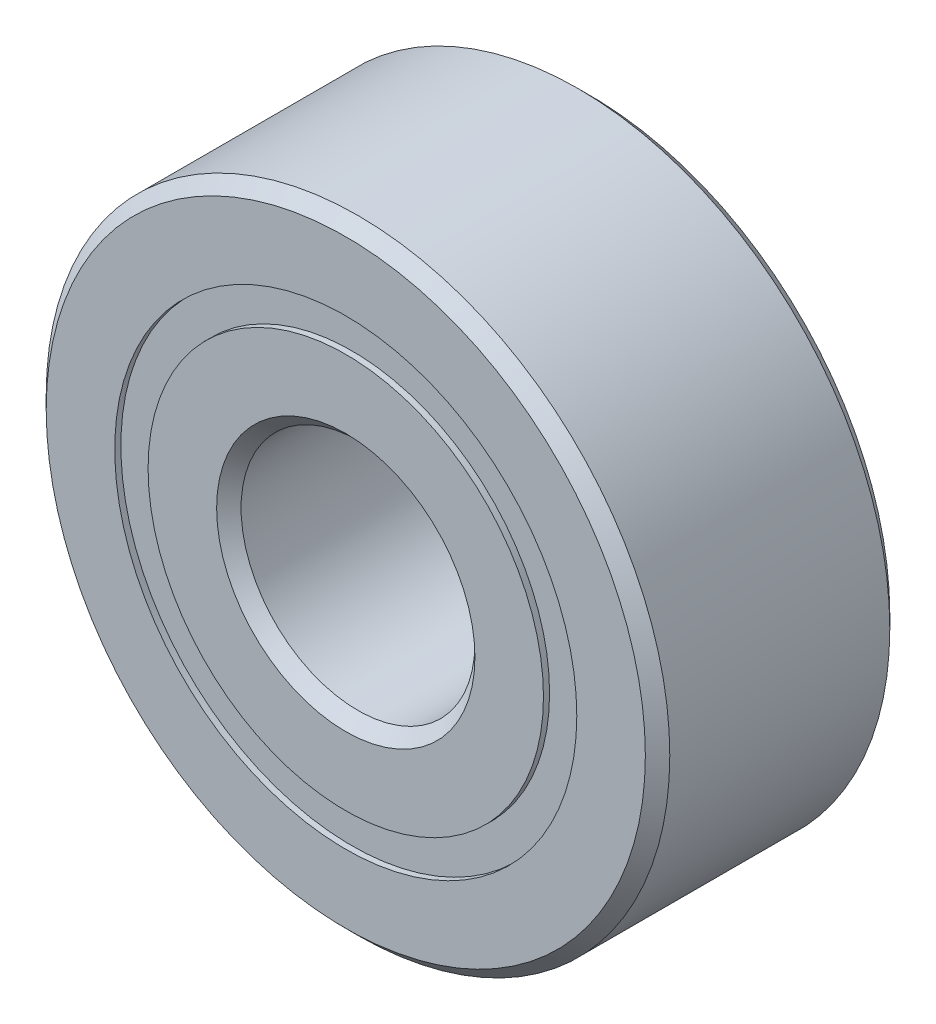
from build123d import *

# Parameters (mm, degrees)
CIRPATTERN1_COUNT = 10
SKETCH5_W         = 1.207534705
SKETCH5_H         = 0.678821978


with BuildPart() as part:
    # Sketch1 → Revolve1 (revolve)
    with BuildSketch(Plane(origin=(0, 0, 0), x_dir=(0, 0, -1), z_dir=(1, 0, 0))):
        with BuildLine():
            Line((2.24028, 6.35), (-2.24028, 6.35))
            Line((-2.24028, 6.35), (-2.4892, 6.10108))
            Line((-2.4892, 6.10108), (-2.4892, 4.705035989))
            Line((-2.4892, 4.705035989), (-1.106311111, 4.705035989))
            ThreePointArc((-1.106311111, 4.705035989), (0, 5.522830295), (1.106311111, 4.705035989))
            Line((1.106311111, 4.705035989), (2.4892, 4.705035989))
            Line((2.4892, 4.705035989), (2.4892, 6.10108))
            Line((2.4892, 6.10108), (2.24028, 6.35))
        make_face()
    revolve(axis=Axis((0, 0, 2.4892), (0, 0, -1)))


with BuildPart() as body_2:
    # Sketch3 → Revolve3 (revolve)
    with BuildSketch(Plane(origin=(0, 0, 0), x_dir=(0, 0, -1), z_dir=(1, 0, 0))):
        with BuildLine():
            Line((-1.106311111, 4.026214011), (-2.4892, 4.026214011))
            Line((-2.4892, 4.026214011), (-2.4892, 2.63017))
            Line((-2.4892, 2.63017), (-2.24028, 2.38125))
            Line((-2.24028, 2.38125), (2.24028, 2.38125))
            Line((2.24028, 2.38125), (2.4892, 2.63017))
            Line((2.4892, 2.63017), (2.4892, 4.026214011))
            Line((2.4892, 4.026214011), (1.106311111, 4.026214011))
            ThreePointArc((1.106311111, 4.026214011), (0, 3.208419705), (-1.106311111, 4.026214011))
        make_face()
    revolve(axis=Axis((0, 0, 2.4892), (0, 0, -1)))


with BuildPart() as body_3:
    # Sketch4 → Revolve4 (revolve)
    with BuildSketch(Plane(origin=(0, 0, 0), x_dir=(0, 0, -1), z_dir=(1, 0, 0))):
        with BuildLine():
            Line((-1.157205295, 4.365625), (1.157205295, 4.365625))
            ThreePointArc((1.157205295, 4.365625), (0, 5.522830295), (-1.157205295, 4.365625))
        make_face()
    revolve(axis=Axis((0, 4.365625, 1.157205295), (0, 0, -1)))


with BuildPart() as cirpattern1_1:
    # CirPattern1: pattern copy
    add(body_3.part.rotate(Axis((0, 0, -2.4892), (0, 0, 1)), 1 * 360 / CIRPATTERN1_COUNT))


with BuildPart() as cirpattern1_2:
    # CirPattern1: pattern copy
    add(body_3.part.rotate(Axis((0, 0, -2.4892), (0, 0, 1)), 2 * 360 / CIRPATTERN1_COUNT))


with BuildPart() as cirpattern1_3:
    # CirPattern1: pattern copy
    add(body_3.part.rotate(Axis((0, 0, -2.4892), (0, 0, 1)), 3 * 360 / CIRPATTERN1_COUNT))


with BuildPart() as cirpattern1_4:
    # CirPattern1: pattern copy
    add(body_3.part.rotate(Axis((0, 0, -2.4892), (0, 0, 1)), 4 * 360 / CIRPATTERN1_COUNT))


with BuildPart() as cirpattern1_5:
    # CirPattern1: pattern copy
    add(body_3.part.rotate(Axis((0, 0, -2.4892), (0, 0, 1)), 5 * 360 / CIRPATTERN1_COUNT))


with BuildPart() as cirpattern1_6:
    # CirPattern1: pattern copy
    add(body_3.part.rotate(Axis((0, 0, -2.4892), (0, 0, 1)), 6 * 360 / CIRPATTERN1_COUNT))


with BuildPart() as cirpattern1_7:
    # CirPattern1: pattern copy
    add(body_3.part.rotate(Axis((0, 0, -2.4892), (0, 0, 1)), 7 * 360 / CIRPATTERN1_COUNT))


with BuildPart() as cirpattern1_8:
    # CirPattern1: pattern copy
    add(body_3.part.rotate(Axis((0, 0, -2.4892), (0, 0, 1)), 8 * 360 / CIRPATTERN1_COUNT))


with BuildPart() as cirpattern1_9:
    # CirPattern1: pattern copy
    add(body_3.part.rotate(Axis((0, 0, -2.4892), (0, 0, 1)), 9 * 360 / CIRPATTERN1_COUNT))


with BuildPart() as body_13:
    # Sketch5 → Revolve5 (revolve)
    with BuildSketch(Plane(origin=(0, 0, 0), x_dir=(0, 0, -1), z_dir=(1, 0, 0))):
        with Locations((-1.760972648, 4.365625)):
            Rectangle(SKETCH5_W, SKETCH5_H)
        with Locations((1.760972648, 4.365625)):
            Rectangle(SKETCH5_W, SKETCH5_H)
    revolve(axis=Axis((0, 0, 2.4892), (0, 0, -1)))


solid = Compound([part.part, body_2.part, body_3.part, cirpattern1_1.part, cirpattern1_2.part, cirpattern1_3.part, cirpattern1_4.part, cirpattern1_5.part, cirpattern1_6.part, cirpattern1_7.part, cirpattern1_8.part, cirpattern1_9.part, body_13.part])
